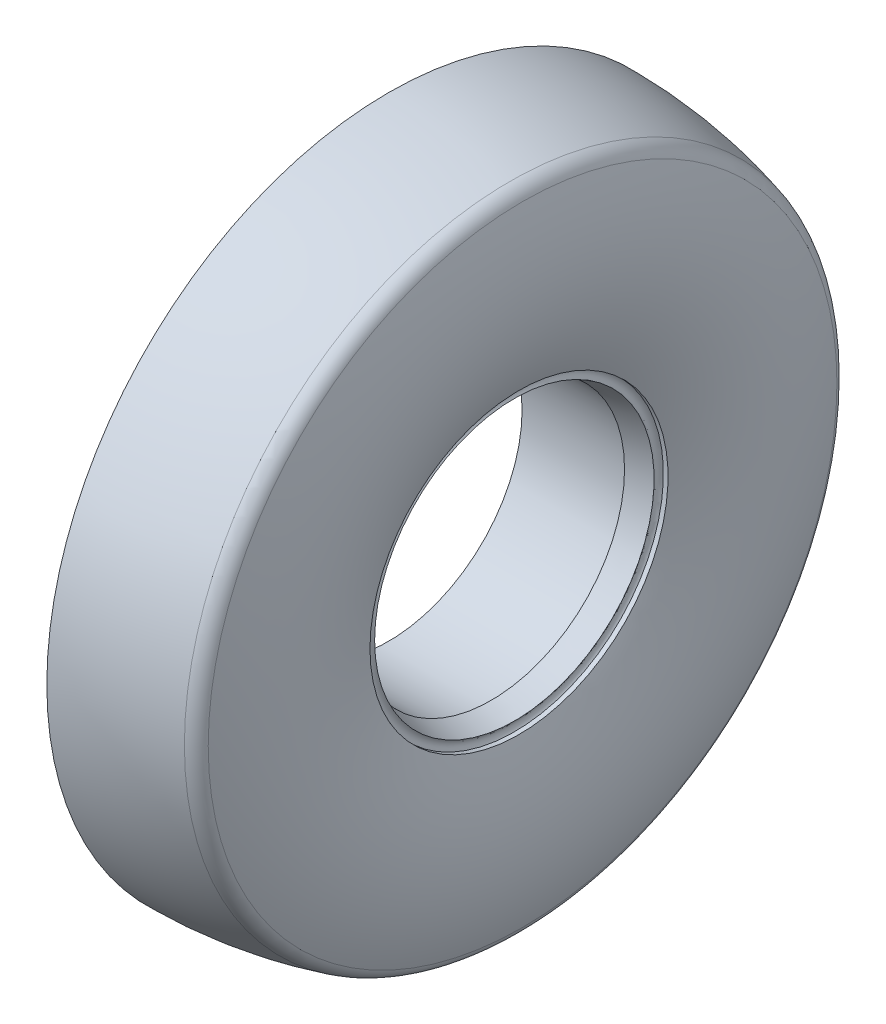
from build123d import *

# Parameters (mm, degrees)
REDONDEO8_R = 1


with BuildPart() as part:
    # Croquis1 → Revolución1 (revolve)
    with BuildSketch(Plane(origin=(0, 0, 0), x_dir=(1, 0, 0), z_dir=(0, 1, 0))):
        with BuildLine():
            ThreePointArc((7, 17.344), (3.535533906, 18.092737342), (0, 18.344))
            Line((0, 18.344), (0, 7.165063509))
            Line((0, 7.165063509), (5.5, 7.165063509))
            Line((5.5, 7.165063509), (6.75, 7.5))
            add(Edge.make_bspline(
                [(6.75, 8), (6.55, 7.75), (6.75, 7.5)],
                knots=[0, 0, 0, 1, 1, 1], degree=2))
            Line((6.75, 8), (7, 8))
            add(Edge.make_bspline(
                [(7, 17.344), (9.000873043, 12.66305), (7, 8)],
                knots=[0, 0, 0, 1, 1, 1], degree=2))
        make_face()
    revolve(axis=Axis((-281.405379576, 0, 0), (1, 0, 0)))

    # Redondeo8
    redondeo8_edges = [part.edges().sort_by_distance(p)[0] for p in [
        (7, 0, 17.344),
    ]]
    fillet(redondeo8_edges, radius=REDONDEO8_R)


solid = part.part
